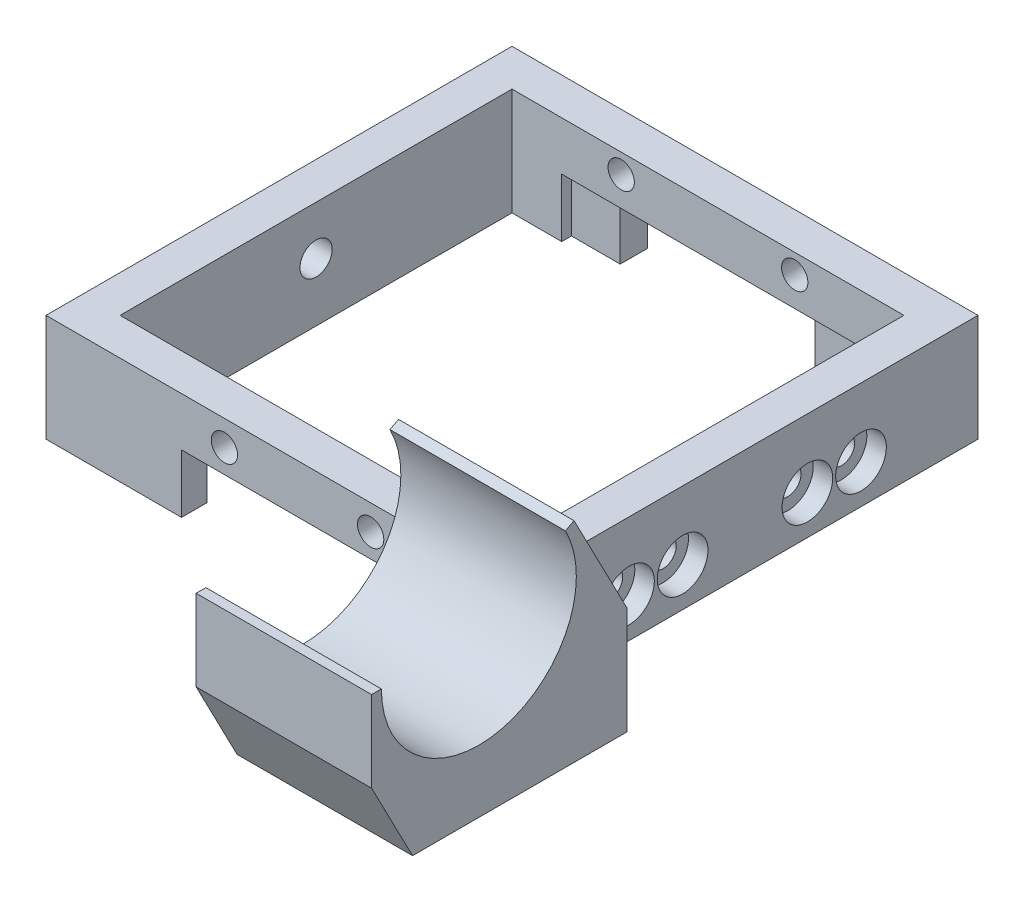
from build123d import *

# Parameters (mm, degrees)
SKETCH1_W                = 47.8
SKETCH1_H                = 47.8
SKETCH1_W_2              = 40.2
SKETCH1_H_2              = 40.2
BOSS_EXTRUDE1_DEPTH      = 11
SKETCH3_W                = 20
SKETCH3_H                = 6
CUT_EXTRUDE1_DEPTH       = 55.562349656
SKETCH4_W                = 5
SKETCH4_H                = 6
CUT_EXTRUDE2_DEPTH       = 1
CUT_EXTRUDE4_REACH       = 56.562
SKETCH6_R                = 1.35
CUT_EXTRUDE5_REACH       = 56.562
SKETCH7_R                = 1.35
CUT_EXTRUDE6_REACH       = 56.562
SKETCH8_R                = 1.35
CUT_EXTRUDE7_REACH       = 56.562
SKETCH9_R                = 1.65
BOSS_EXTRUDE7_DEPTH      = 8
BOSS_EXTRUDE7_DEPTH_BACK = 10
SKETCH5_W                = 5
SKETCH5_H                = 6
CUT_EXTRUDE3_DEPTH       = 1.2
SKETCH11_R               = 2.6
CUT_EXTRUDE8_DEPTH       = 2


with BuildPart() as part:
    # Sketch1 → Boss-Extrude1 (new body)
    with BuildSketch(Plane(origin=(0, 0, 0), x_dir=(1, 0, 0), z_dir=(0, 1, 0))):
        Rectangle(SKETCH1_W, SKETCH1_H)
        Rectangle(SKETCH1_W_2, SKETCH1_H_2, mode=Mode.SUBTRACT)
    extrude(amount=BOSS_EXTRUDE1_DEPTH)

    # Sketch3 → Cut-Extrude1 (cut, through all)
    with BuildSketch(Plane.XY.offset(23.9)):
        with Locations((0, 3)):
            Rectangle(SKETCH3_W, SKETCH3_H)
    extrude(amount=-CUT_EXTRUDE1_DEPTH, mode=Mode.SUBTRACT)

    # Sketch4 → Cut-Extrude2 (cut)
    with BuildSketch(Plane.XY.offset(-20.1)):
        with Locations((-12.5, 3)):
            Rectangle(SKETCH4_W, SKETCH4_H)
        with Locations((12.5, 3)):
            Rectangle(SKETCH4_W, SKETCH4_H)
    extrude(amount=-CUT_EXTRUDE2_DEPTH, mode=Mode.SUBTRACT)

    # Sketch6 → Cut-Extrude4 (cut, up to next)
    with BuildSketch(Plane(origin=(0, 0, -23.9), x_dir=(-1, 0, 0), z_dir=(0, 0, -1)), mode=Mode.PRIVATE) as cut_extrude4_sk1:
        with Locations((-8.9, 9)):
            Circle(SKETCH6_R)
    cut_extrude4_tool1 = extrude(cut_extrude4_sk1.sketch, amount=-CUT_EXTRUDE4_REACH, mode=Mode.PRIVATE) & part.part
    # Sketch6 → Cut-Extrude4 (cut, up to next)
    with BuildSketch(Plane(origin=(0, 0, -23.9), x_dir=(-1, 0, 0), z_dir=(0, 0, -1)), mode=Mode.PRIVATE) as cut_extrude4_sk2:
        with Locations((8.9, 9)):
            Circle(SKETCH6_R)
    cut_extrude4_tool2 = extrude(cut_extrude4_sk2.sketch, amount=-CUT_EXTRUDE4_REACH, mode=Mode.PRIVATE) & part.part
    add(cut_extrude4_tool1.solids().sort_by_distance((8.9, 9, -23.9))[0], mode=Mode.SUBTRACT)
    add(cut_extrude4_tool2.solids().sort_by_distance((-8.9, 9, -23.9))[0], mode=Mode.SUBTRACT)

    # Sketch7 → Cut-Extrude5 (cut, up to next)
    with BuildSketch(Plane.XY.offset(23.9), mode=Mode.PRIVATE) as cut_extrude5_sk1:
        with Locations((9.4, 8.412816521)):
            Circle(SKETCH7_R)
    cut_extrude5_tool1 = extrude(cut_extrude5_sk1.sketch, amount=-CUT_EXTRUDE5_REACH, mode=Mode.PRIVATE) & part.part
    # Sketch7 → Cut-Extrude5 (cut, up to next)
    with BuildSketch(Plane.XY.offset(23.9), mode=Mode.PRIVATE) as cut_extrude5_sk2:
        with Locations((-5.6, 8.412816521)):
            Circle(SKETCH7_R)
    cut_extrude5_tool2 = extrude(cut_extrude5_sk2.sketch, amount=-CUT_EXTRUDE5_REACH, mode=Mode.PRIVATE) & part.part
    add(cut_extrude5_tool1.solids().sort_by_distance((9.4, 8.412817, 23.9))[0], mode=Mode.SUBTRACT)
    add(cut_extrude5_tool2.solids().sort_by_distance((-5.6, 8.412817, 23.9))[0], mode=Mode.SUBTRACT)

    # Sketch8 → Cut-Extrude6 (cut, up to next)
    with BuildSketch(Plane(origin=(23.9, 0, 0), x_dir=(0, 0, -1), z_dir=(1, 0, 0)), mode=Mode.PRIVATE) as cut_extrude6_sk1:
        with Locations((-11.9, 4)):
            Circle(SKETCH8_R)
    cut_extrude6_tool1 = extrude(cut_extrude6_sk1.sketch, amount=-CUT_EXTRUDE6_REACH, mode=Mode.PRIVATE) & part.part
    # Sketch8 → Cut-Extrude6 (cut, up to next)
    with BuildSketch(Plane(origin=(23.9, 0, 0), x_dir=(0, 0, -1), z_dir=(1, 0, 0)), mode=Mode.PRIVATE) as cut_extrude6_sk2:
        with Locations((-6.4, 4)):
            Circle(SKETCH8_R)
    cut_extrude6_tool2 = extrude(cut_extrude6_sk2.sketch, amount=-CUT_EXTRUDE6_REACH, mode=Mode.PRIVATE) & part.part
    # Sketch8 → Cut-Extrude6 (cut, up to next)
    with BuildSketch(Plane(origin=(23.9, 0, 0), x_dir=(0, 0, -1), z_dir=(1, 0, 0)), mode=Mode.PRIVATE) as cut_extrude6_sk3:
        with Locations(Location((6.4, 4, 0), (0, 0, 180))):
            Circle(SKETCH8_R)
    cut_extrude6_tool3 = extrude(cut_extrude6_sk3.sketch, amount=-CUT_EXTRUDE6_REACH, mode=Mode.PRIVATE) & part.part
    # Sketch8 → Cut-Extrude6 (cut, up to next)
    with BuildSketch(Plane(origin=(23.9, 0, 0), x_dir=(0, 0, -1), z_dir=(1, 0, 0)), mode=Mode.PRIVATE) as cut_extrude6_sk4:
        with Locations(Location((11.9, 4, 0), (0, 0, 180))):
            Circle(SKETCH8_R)
    cut_extrude6_tool4 = extrude(cut_extrude6_sk4.sketch, amount=-CUT_EXTRUDE6_REACH, mode=Mode.PRIVATE) & part.part
    add(cut_extrude6_tool1.solids().sort_by_distance((23.9, 4, 11.9))[0], mode=Mode.SUBTRACT)
    add(cut_extrude6_tool2.solids().sort_by_distance((23.9, 4, 6.4))[0], mode=Mode.SUBTRACT)
    add(cut_extrude6_tool3.solids().sort_by_distance((23.9, 4, -6.4))[0], mode=Mode.SUBTRACT)
    add(cut_extrude6_tool4.solids().sort_by_distance((23.9, 4, -11.9))[0], mode=Mode.SUBTRACT)

    # Sketch9 → Cut-Extrude7 (cut, up to next)
    with BuildSketch(Plane.ZY.offset(23.9), mode=Mode.PRIVATE) as cut_extrude7_sk1:
        with Locations((0, 6)):
            Circle(SKETCH9_R)
    cut_extrude7_tool1 = extrude(cut_extrude7_sk1.sketch, amount=-CUT_EXTRUDE7_REACH, mode=Mode.PRIVATE) & part.part
    add(cut_extrude7_tool1.solids().sort_by_distance((-23.9, 6, 0))[0], mode=Mode.SUBTRACT)

    # Sketch10 → Boss-Extrude7 (add, two sides: drawn at the far end of the back side and taken through both)
    with BuildSketch(Plane(origin=(23.9, 0, 0), x_dir=(0, 0, -1), z_dir=(1, 0, 0)).offset(-BOSS_EXTRUDE7_DEPTH_BACK)):
        with BuildLine():
            Line((-42.1, 0), (-20.1, 0))
            Line((-20.1, 0), (-20.1, 11))
            Line((-20.1, 11), (-25.535668372, 21.478172171))
            ThreePointArc((-25.535668372, 21.478172171), (-32.693052351, 5.7261976), (-46.3, 16.412816521))
            Line((-46.3, 16.412816521), (-46.3, 8.096211929))
            Line((-46.3, 8.096211929), (-42.1, 0))
        make_face()
        with BuildLine():
            ThreePointArc((-46.3, 16.412816521), (-32.693052351, 5.7261976), (-25.535668372, 21.478172171))
            Line((-25.535668372, 21.478172171), (-26.423334884, 21.017685293))
            ThreePointArc((-26.423334884, 21.017685293), (-32.930047592, 6.697708411), (-45.3, 16.412816521))
            Line((-45.3, 16.412816521), (-46.3, 16.412816521))
        make_face()
    extrude(amount=BOSS_EXTRUDE7_DEPTH + BOSS_EXTRUDE7_DEPTH_BACK)

    # Sketch5 → Cut-Extrude3 (cut)
    with BuildSketch(Plane(origin=(0, 0, 20.1), x_dir=(-1, 0, 0), z_dir=(0, 0, -1))):
        with Locations((-12.5, 3)):
            Rectangle(SKETCH5_W, SKETCH5_H)
        with Locations((12.5, 3)):
            Rectangle(SKETCH5_W, SKETCH5_H)
    extrude(amount=-CUT_EXTRUDE3_DEPTH, mode=Mode.SUBTRACT)

    # Sketch11 → Cut-Extrude8 (cut)
    with BuildSketch(Plane(origin=(23.9, 0, 0), x_dir=(0, 0, -1), z_dir=(1, 0, 0))):
        with Locations((11.9, 4)):
            Circle(SKETCH11_R)
        with Locations((6.4, 4)):
            Circle(SKETCH11_R)
        with Locations((-6.4, 4)):
            Circle(SKETCH11_R)
        with Locations((-11.9, 4)):
            Circle(SKETCH11_R)
    extrude(amount=-CUT_EXTRUDE8_DEPTH, mode=Mode.SUBTRACT)


solid = part.part
